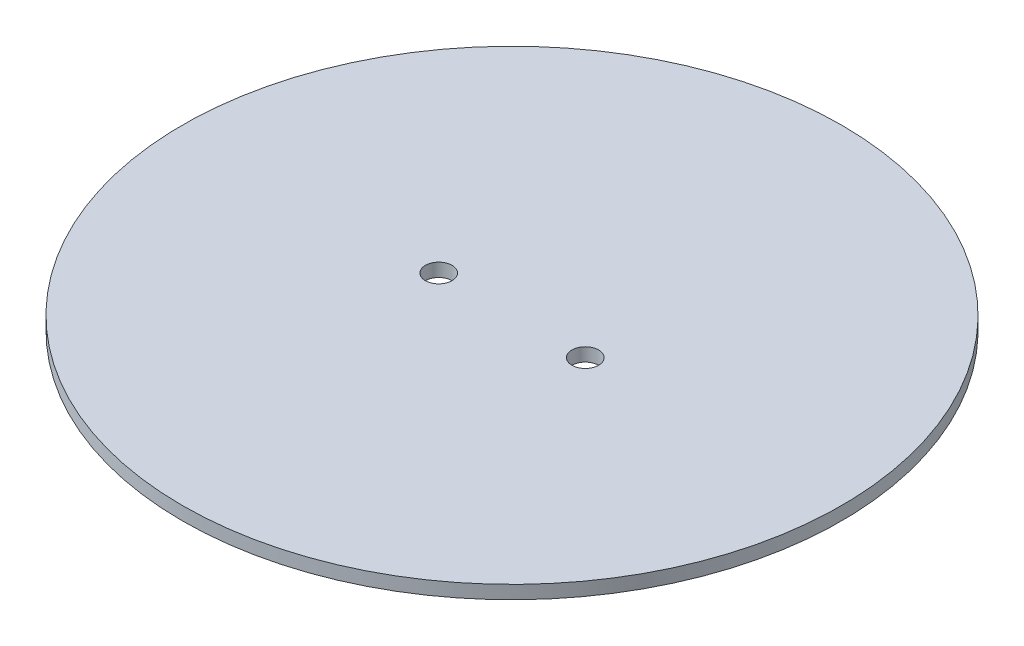
from build123d import *

# Parameters (mm, degrees)
SKETCH1_R           = 74.2
SKETCH1_R_2         = 3
BOSS_EXTRUDE1_DEPTH = 3


with BuildPart() as part:
    # Sketch1 → Boss-Extrude1 (new body)
    with BuildSketch(Plane(origin=(0, 0, 0), x_dir=(1, 0, 0), z_dir=(0, 1, 0))):
        with Locations(Location((0, 0, 0), (0, 0, 270))):
            Circle(SKETCH1_R)
        with Locations(Location((-16.5, 0, 0), (0, 0, 270))):
            Circle(SKETCH1_R_2, mode=Mode.SUBTRACT)
        with Locations(Location((16.5, 0, 0), (0, 0, 270))):
            Circle(SKETCH1_R_2, mode=Mode.SUBTRACT)
    extrude(amount=BOSS_EXTRUDE1_DEPTH)


solid = part.part
